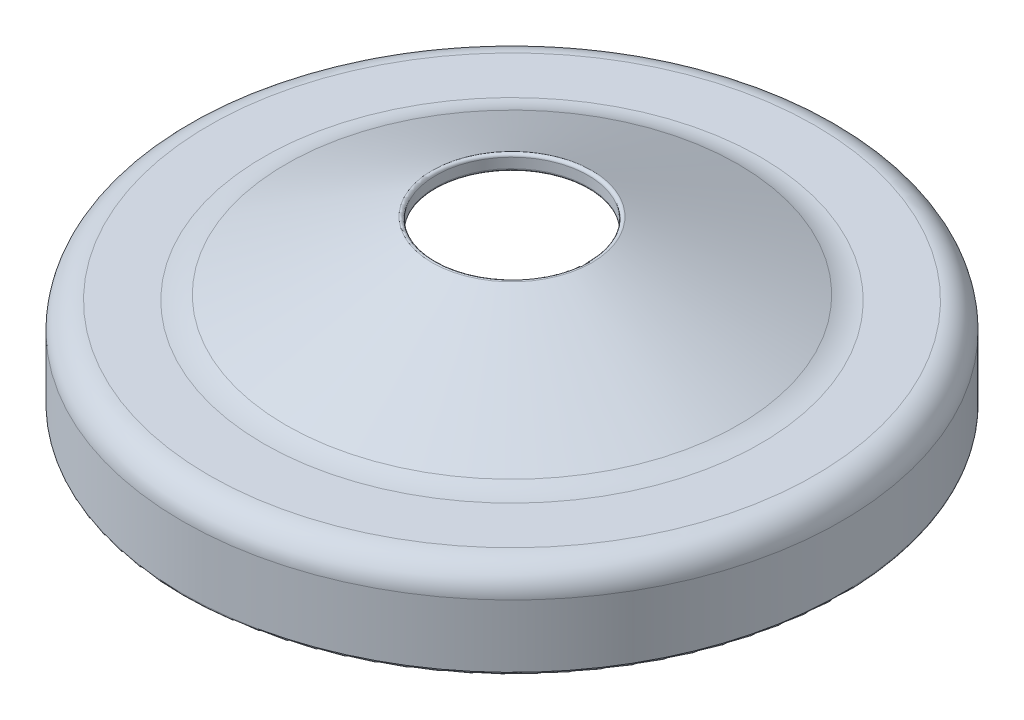
from build123d import *

# Parameters (mm, degrees)
FILLET1_R = 5
FILLET2_R = 2.3
FILLET3_R = 10
FILLET4_R = 12.7
FILLET5_R = 0.5


with BuildPart() as part:
    # Sketch1 → Revolve1 (revolve)
    with BuildSketch(Plane.XY, mode=Mode.PRIVATE) as revolve1_sk:
        Polygon((-14.35, 0), (-44.6, -14), (-62.1, -14), (-62.1, -31.3), (-59.4, -31.3), (-59.4, -16.7), (-44.005497769, -16.7), (-14.35, -2.975141528), align=None)
    revolve(revolve1_sk.sketch.rotate(Axis((0, 0, 0), (0, 1, 0)), 270), axis=Axis((0, 0, 0), (0, 1, 0)))

    # Fillet1
    fillet1_edges = [part.edges().sort_by_distance(p)[0] for p in [
        (0, -14, 62.1),
    ]]
    fillet(fillet1_edges, radius=FILLET1_R)

    # Fillet2
    fillet2_edges = [part.edges().sort_by_distance(p)[0] for p in [
        (0, -16.7, 59.4),
    ]]
    fillet(fillet2_edges, radius=FILLET2_R)

    # Fillet3
    fillet3_edges = [part.edges().sort_by_distance(p)[0] for p in [
        (0, -14, 44.6),
    ]]
    fillet(fillet3_edges, radius=FILLET3_R)

    # Fillet4
    fillet4_edges = [part.edges().sort_by_distance(p)[0] for p in [
        (0, -16.7, 44.005497769),
    ]]
    fillet(fillet4_edges, radius=FILLET4_R)

    # Fillet5
    fillet5_edges = [part.edges().sort_by_distance(p)[0] for p in [
        (0, 0, 14.35),
        (0, -31.3, 62.1),
        (0, -31.3, 59.4),
        (0, -2.975141528, 14.35),
    ]]
    fillet(fillet5_edges, radius=FILLET5_R)


solid = part.part
